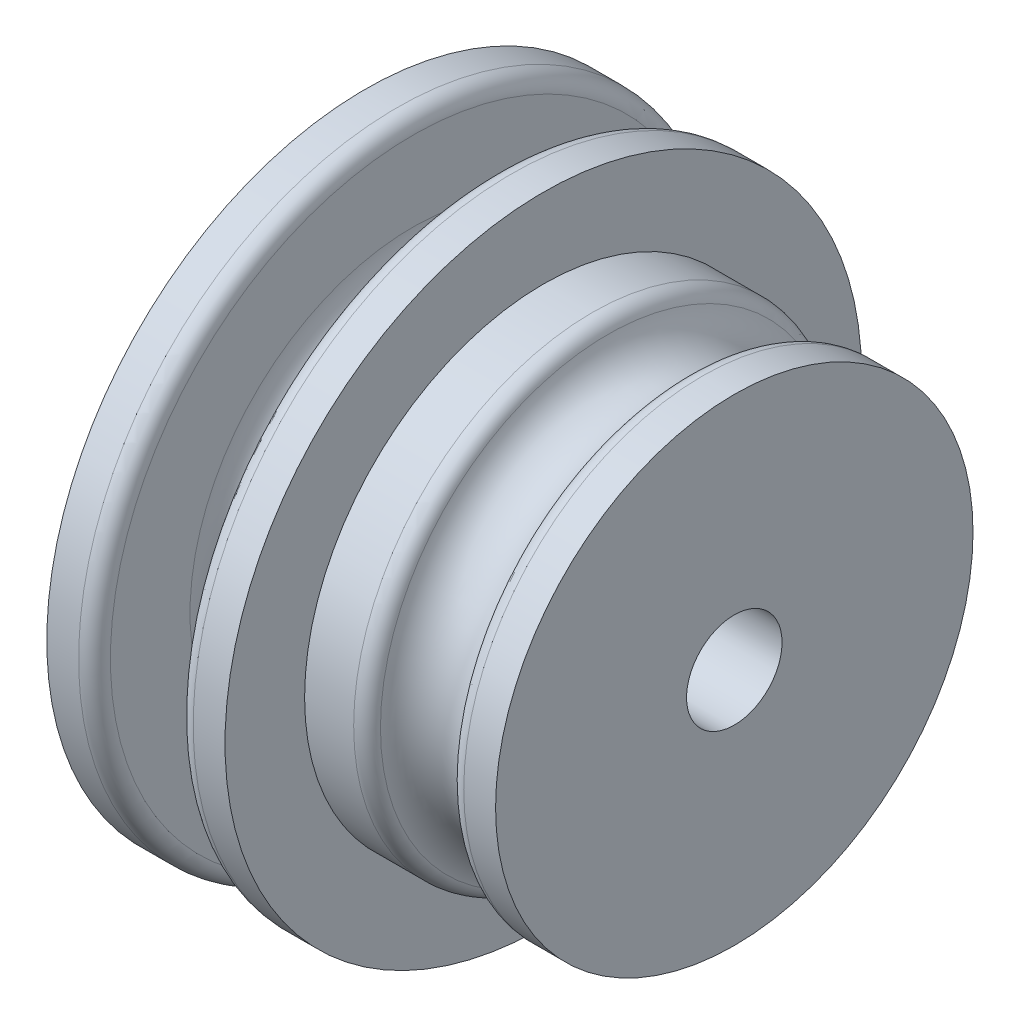
from build123d import *

# Parameters (mm, degrees)
SKETCH2_R          = 1.5
CUT_EXTRUDE1_DEPTH = 19.290981439


with BuildPart() as part:
    # Sketch1 → Revolve1 (revolve)
    with BuildSketch(Plane(origin=(0, 0, 0), x_dir=(-1, 0, 0), z_dir=(0, 1, 0))):
        with BuildLine():
            Line((-5.6, 7.5), (-5.6, 0))
            Line((-5.6, 0), (0, 0))
            Line((0, 0), (0, 10))
            Line((0, 10), (-1, 10))
            ThreePointArc((-1, 10), (-1.353553391, 9.853553391), (-1.5, 9.5))
            Line((-1.5, 9.5), (-1.5, 7))
            ThreePointArc((-1.5, 7), (-2.8, 5.7), (-4.1, 7))
            Line((-4.1, 7), (-4.1, 9.5))
            ThreePointArc((-4.1, 9.5), (-4.246446609, 9.853553391), (-4.6, 10))
            Line((-4.6, 10), (-5.6, 10))
            Line((-5.6, 10), (-5.6, 7.5))
        make_face()
    revolve(axis=Axis((11.6, 0, 0), (-1, 0, 0)))

    # Sketch1<3> → Revolve2 (revolve)
    with BuildSketch(Plane(origin=(0, 0, 0), x_dir=(-1, 0, 0), z_dir=(0, 1, 0))):
        with BuildLine():
            Line((-11.6, 7.5), (-11.6, 0))
            Line((-11.6, 0), (-5.6, 0))
            Line((-5.6, 0), (-5.6, 7.5))
            Line((-5.6, 7.5), (-7.141676707, 7.5))
            ThreePointArc((-7.141676707, 7.5), (-7.442139313, 7.399652627), (-7.621999386, 7.138888889))
            ThreePointArc((-7.621999386, 7.138888889), (-8.870838353, 6.2), (-10.11967732, 7.138888889))
            ThreePointArc((-10.11967732, 7.138888889), (-10.299537394, 7.399652627), (-10.6, 7.5))
            Line((-10.6, 7.5), (-11.6, 7.5))
        make_face()
    revolve(axis=Axis((11.6, 0, 0), (-1, 0, 0)))

    # Sketch2 → Cut-Extrude1 (cut, through all)
    with BuildSketch(Plane.YZ):
        Circle(SKETCH2_R)
    extrude(amount=CUT_EXTRUDE1_DEPTH, mode=Mode.SUBTRACT)


solid = part.part
